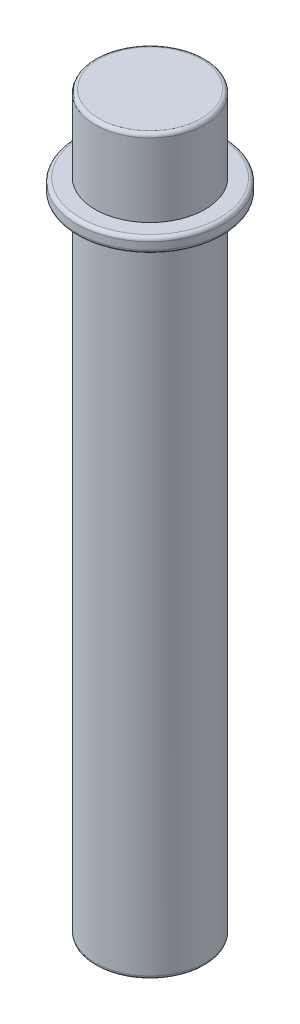
from build123d import *

# Parameters (mm, degrees)
SKETCH_1_R      = 1.5
EXTRUDE_1_DEPTH = 20
EXTRUDE_START   = 2.5
SKETCH_2_R      = 2
SKETCH_2_R_2    = 1.5
EXTRUDE_2_DEPTH = 0.4
FILLET_1_R      = 0.1


with BuildPart() as part:
    # 草图1 → 凸台-拉伸1 (new body)
    with BuildSketch(Plane(origin=(0, 0, 0), x_dir=(1, 0, 0), z_dir=(0, 1, 0))):
        with Locations(Location((0, 0, 0), (0, 0, 270))):
            Circle(SKETCH_1_R)
    extrude(amount=EXTRUDE_1_DEPTH)

    # 草图2 → 凸台-拉伸2 (add)
    with BuildSketch(Plane.XZ.offset(-20).offset(EXTRUDE_START)):
        with Locations(Location((0, 0, 0), (0, 0, 270))):
            Circle(SKETCH_2_R)
        with Locations(Location((0, 0, 0), (0, 0, 270))):
            Circle(SKETCH_2_R_2, mode=Mode.SUBTRACT)
    extrude(amount=-EXTRUDE_2_DEPTH)

    # 圆角1
    fillet_1_edges = [part.edges().sort_by_distance(p)[0] for p in [
        (0, 0, -1.5),
        (0, 20, -1.5),
        (0, 17.5, 2),
        (0, 17.9, 2),
    ]]
    fillet(fillet_1_edges, radius=FILLET_1_R)


solid = part.part
